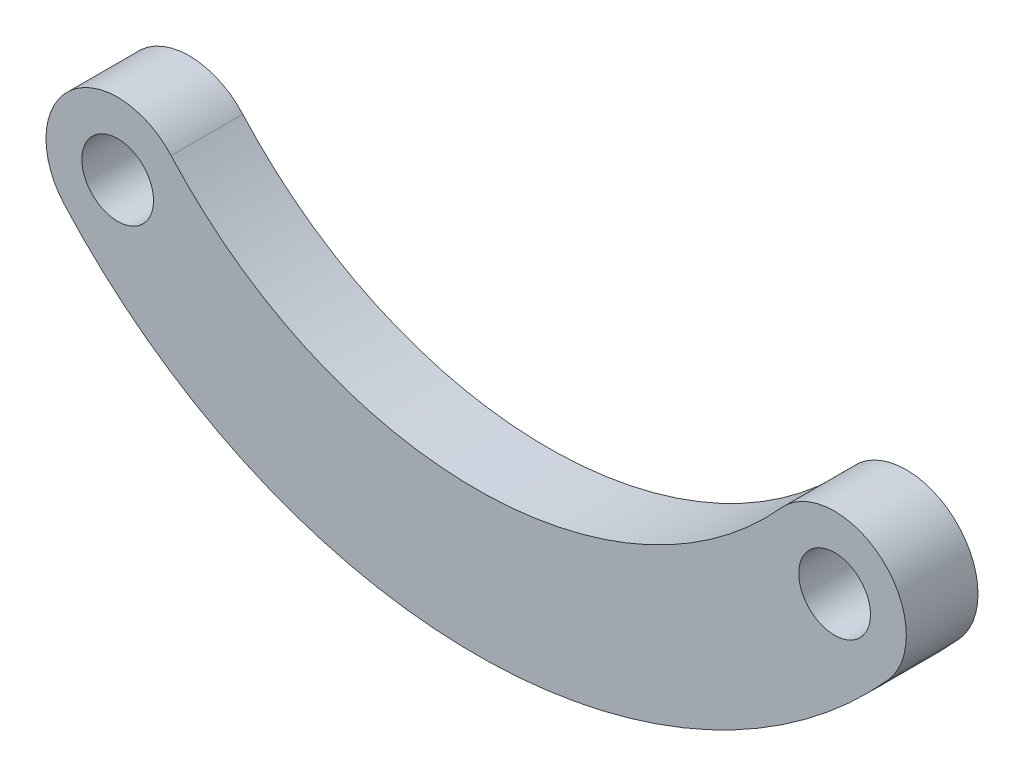
from build123d import *

# Parameters (mm, degrees)
SKETCH1_R           = 9.525
BOSS_EXTRUDE1_DEPTH = 19.05


with BuildPart() as part:
    # Sketch1 → Boss-Extrude1 (new body)
    with BuildSketch(Plane.XY):
        with BuildLine():
            ThreePointArc((81.058378375, -72.585965178), (107.958279807, -71.10262336), (109.441621625, -98.002524792))
            ThreePointArc((109.441621625, -98.002524792), (0, -146.908010025), (-109.441621625, -98.002524792))
            ThreePointArc((-109.441621625, -98.002524792), (-107.958279807, -71.10262336), (-81.058378375, -72.585965178))
            ThreePointArc((-81.058378375, -72.585965178), (0, -108.808010025), (81.058378375, -72.585965178))
        make_face()
        with Locations(Location((-95.25, -85.294244985, 0), (0, 0, 180))):
            Circle(SKETCH1_R, mode=Mode.SUBTRACT)
        with Locations(Location((95.25, -85.294244985, 0), (0, 0, 180))):
            Circle(SKETCH1_R, mode=Mode.SUBTRACT)
    extrude(amount=BOSS_EXTRUDE1_DEPTH)


solid = part.part
